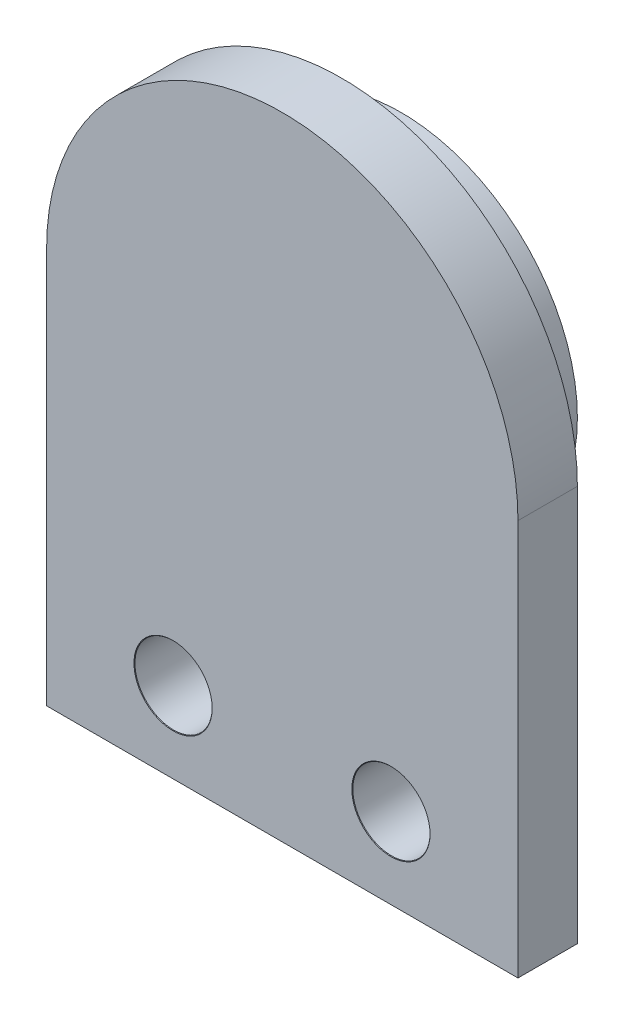
from build123d import *

# Parameters (mm, degrees)
BOSS_EXTRUDE1_DEPTH             = 3
SKETCH2_R                       = 8.9
BOSS_EXTRUDE2_DEPTH             = 3
SKETCH3_R                       = 2
BOSS_EXTRUDE3_DEPTH             = 3
M3_5_CLEARANCE_HOLE1_AT_2_COUNT = 2
M3_5_CLEARANCE_HOLE1_AT_2_PITCH = 11
M3_5_CLEARANCE_HOLE1_AT_3_COUNT = 2
M3_5_CLEARANCE_HOLE1_AT_3_PITCH = 11


with BuildPart() as part:
    # Sketch1 → Boss-Extrude1 (new body)
    with BuildSketch(Plane.XY):
        with BuildLine():
            Line((-11.9, 0), (-11.9, -20))
            Line((-11.9, -20), (11.9, -20))
            Line((11.9, -20), (11.9, 0))
            ThreePointArc((11.9, 0), (0, 11.9), (-11.9, 0))
        make_face()
    extrude(amount=BOSS_EXTRUDE1_DEPTH)

    # Sketch2 → Boss-Extrude2 (add)
    with BuildSketch(Plane(origin=(0, 0, 0), x_dir=(-1, 0, 0), z_dir=(0, 0, -1))):
        Circle(SKETCH2_R)
    extrude(amount=BOSS_EXTRUDE2_DEPTH)

    # Sketch3 → Boss-Extrude3 (add)
    with BuildSketch(Plane(origin=(0, 0, -3), x_dir=(-1, 0, 0), z_dir=(0, 0, -1))):
        Circle(SKETCH3_R)
    extrude(amount=BOSS_EXTRUDE3_DEPTH)

    # Sketch5 → M3.5 Clearance Hole1 (revolve, cut)
    with BuildSketch(Plane(origin=(-5.515156433, -15.92620122, 3), x_dir=(0, -1, 0), z_dir=(1, 0, 0))):
        Polygon((0, 0), (0, 9), (1.95, 9), (1.95, 0.025), (1.975, 0), align=None)
    m3_5_clearance_hole1 = revolve(axis=Axis((-5.515156433, -15.92620122, 9.35), (0, 0, -1)), mode=Mode.SUBTRACT)

    # M3.5 Clearance Hole1 at 2: M3.5 Clearance Hole1 ×2
    with Locations(*[(i * M3_5_CLEARANCE_HOLE1_AT_2_PITCH, 0, 0) for i in range(1, M3_5_CLEARANCE_HOLE1_AT_2_COUNT)]):
        add(m3_5_clearance_hole1, mode=Mode.SUBTRACT)

    # M3.5 Clearance Hole1 at 3: M3.5 Clearance Hole1 ×2
    with Locations(*[(i * M3_5_CLEARANCE_HOLE1_AT_3_PITCH, 0, 0) for i in range(1, M3_5_CLEARANCE_HOLE1_AT_3_COUNT)]):
        add(m3_5_clearance_hole1, mode=Mode.SUBTRACT)


solid = part.part
